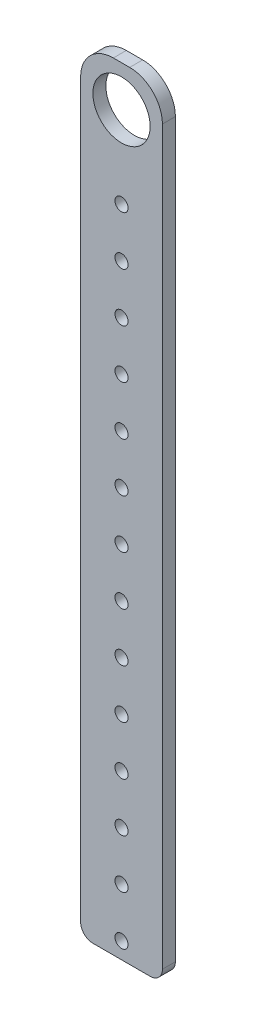
from build123d import *

# Parameters (mm, degrees)
SKETCH1_W           = 20
SKETCH1_H           = 190
SKETCH1_R           = 1.6
SKETCH1_R_2         = 7
BOSS_EXTRUDE1_DEPTH = 3.175
FILLET1_R           = 3
FILLET2_R           = 8


with BuildPart() as part:
    # Sketch1 → Boss-Extrude1 (new body)
    with BuildSketch(Plane.XY):
        Rectangle(SKETCH1_W, SKETCH1_H)
        with Locations((0, -91)):
            Circle(SKETCH1_R, mode=Mode.SUBTRACT)
        with Locations((0, -79)):
            Circle(SKETCH1_R, mode=Mode.SUBTRACT)
        with Locations((0, -67)):
            Circle(SKETCH1_R, mode=Mode.SUBTRACT)
        with Locations((0, -55)):
            Circle(SKETCH1_R, mode=Mode.SUBTRACT)
        with Locations((0, -43)):
            Circle(SKETCH1_R, mode=Mode.SUBTRACT)
        with Locations((0, -31)):
            Circle(SKETCH1_R, mode=Mode.SUBTRACT)
        with Locations((0, -19)):
            Circle(SKETCH1_R, mode=Mode.SUBTRACT)
        with Locations((0, 85)):
            Circle(SKETCH1_R_2, mode=Mode.SUBTRACT)
        with Locations((0, -7)):
            Circle(SKETCH1_R, mode=Mode.SUBTRACT)
        with Locations((0, 5)):
            Circle(SKETCH1_R, mode=Mode.SUBTRACT)
        with Locations((0, 17)):
            Circle(SKETCH1_R, mode=Mode.SUBTRACT)
        with Locations((0, 29)):
            Circle(SKETCH1_R, mode=Mode.SUBTRACT)
        with Locations((0, 41)):
            Circle(SKETCH1_R, mode=Mode.SUBTRACT)
        with Locations((0, 53)):
            Circle(SKETCH1_R, mode=Mode.SUBTRACT)
        with Locations((0, 65)):
            Circle(SKETCH1_R, mode=Mode.SUBTRACT)
    extrude(amount=BOSS_EXTRUDE1_DEPTH)

    # Fillet1
    fillet1_edges = [part.edges().sort_by_distance(p)[0] for p in [
        (10, -95, 1.5875),
        (-10, -95, 1.5875),
    ]]
    fillet(fillet1_edges, radius=FILLET1_R)

    # Fillet2
    fillet2_edges = [part.edges().sort_by_distance(p)[0] for p in [
        (-10, 95, 1.5875),
        (10, 95, 1.5875),
    ]]
    fillet(fillet2_edges, radius=FILLET2_R)


solid = part.part
